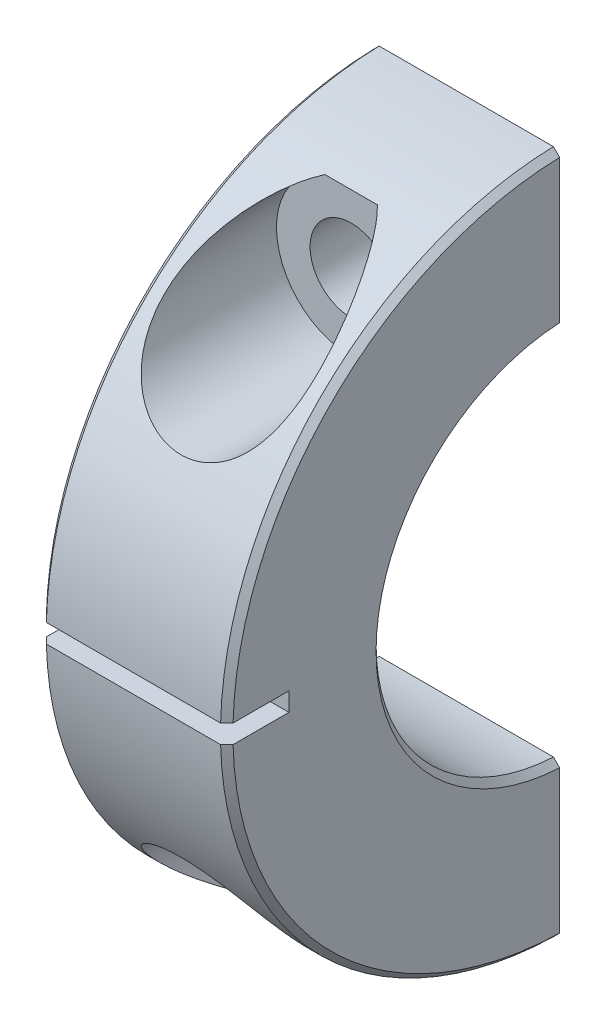
from build123d import *

# Parameters (mm, degrees)
BOSS_EXTRUDE1_DEPTH                     = 15
CUT_EXTRUDE1_DEPTH                      = 42.676582154
CUT_EXTRUDE2_DEPTH                      = 42.669833213
CBORE_FOR_M6_HEX_HEAD_BOLT1_D           = 6.6
CBORE_FOR_M6_HEX_HEAD_BOLT1_CBORE_D     = 12
CBORE_FOR_M6_HEX_HEAD_BOLT1_CBORE_DEPTH = 13.669600757
CHAMFER1_SIZE                           = 0.5


with BuildPart() as part:
    # Sketch1 → Boss-Extrude1 (new body)
    with BuildSketch(Plane(origin=(-7.5, 0, 0), x_dir=(0, -1, 0), z_dir=(-1, 0, 0))):
        with BuildLine():
            Line((-27.489770825, 0.75), (27.489770825, 0.75))
            ThreePointArc((27.489770825, 0.75), (0, 27.5), (-27.489770825, 0.75))
        make_face()
    extrude(amount=-BOSS_EXTRUDE1_DEPTH)

    # Sketch2 → Cut-Extrude1 (cut, through all)
    with BuildSketch(Plane(origin=(7.5, 0, 0), x_dir=(0, 0, -1), z_dir=(1, 0, 0))):
        with BuildLine():
            Line((-27.489770825, -0.75), (-22.5, -0.75))
            Line((-22.5, -0.75), (-22.5, 0.75))
            Line((-22.5, 0.75), (-27.489770825, 0.75))
            ThreePointArc((-27.489770825, 0.75), (-27.5, 0), (-27.489770825, -0.75))
        make_face()
    extrude(amount=-CUT_EXTRUDE1_DEPTH, mode=Mode.SUBTRACT)

    # Sketch3 → Cut-Extrude2 (cut, through all)
    with BuildSketch(Plane(origin=(7.5, 0, 0), x_dir=(0, 0, -1), z_dir=(1, 0, 0))):
        with BuildLine():
            Line((-0.75, -14.981238267), (-0.75, 14.981238267))
            ThreePointArc((-0.75, 14.981238267), (-15, 0), (-0.75, -14.981238267))
        make_face()
    extrude(amount=-CUT_EXTRUDE2_DEPTH, mode=Mode.SUBTRACT)

    # CBORE for M6 Hex Head Bolt1 (through all)
    with Locations(Plane.XY.offset(23.669600757)):
        with Locations((0, -20), (0, 20)):
            CounterBoreHole(CBORE_FOR_M6_HEX_HEAD_BOLT1_D / 2, CBORE_FOR_M6_HEX_HEAD_BOLT1_CBORE_D / 2, CBORE_FOR_M6_HEX_HEAD_BOLT1_CBORE_DEPTH)

    # Chamfer1
    chamfer1_edges = [part.edges().sort_by_distance(p)[0] for p in [
        (7.5, 19.445436483, 19.445436483),
        (-7.5, 0, 15),
        (7.5, 0, 15),
        (-7.5, -19.445436483, 19.445436483),
        (7.5, -19.445436483, 19.445436483),
        (-7.5, 19.445436483, 19.445436483),
    ]]
    chamfer(chamfer1_edges, length=CHAMFER1_SIZE)


solid = part.part
